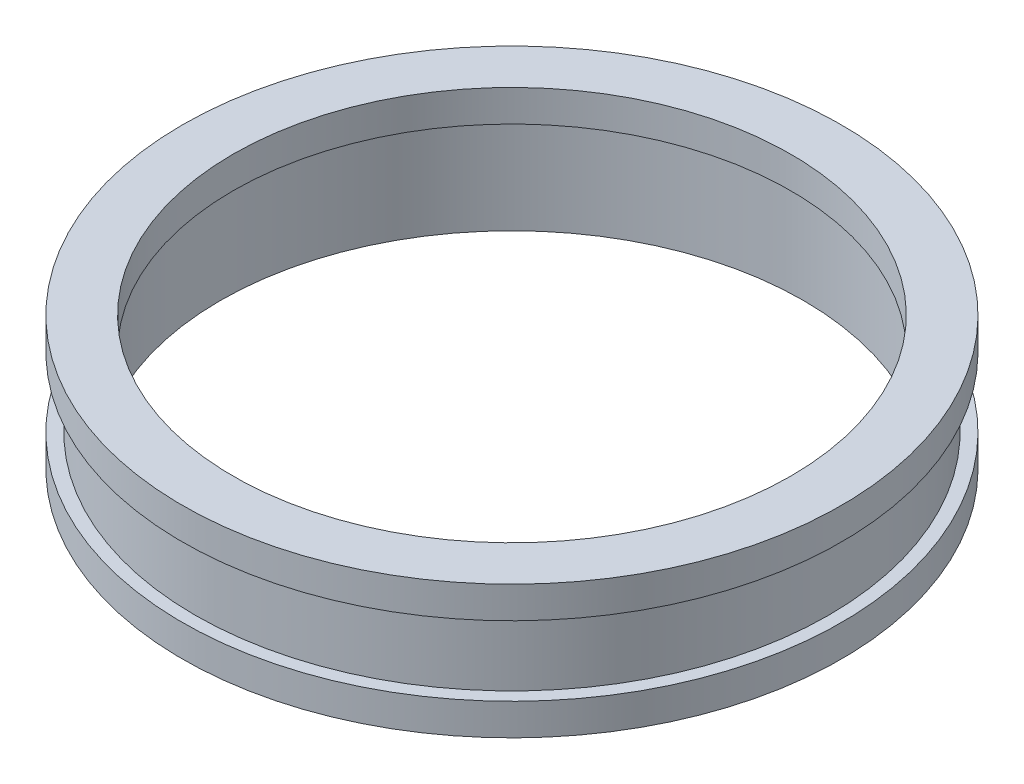
from build123d import *


with BuildPart() as part:
    # Sketch1 → Revolve1 (revolve)
    with BuildSketch(Plane(origin=(0, 0, 0), x_dir=(-1, 0, 0), z_dir=(0, 0, -1)), mode=Mode.PRIVATE) as revolve1_sk:
        Polygon((-44, 4.381196481), (-44, -0.618803519), (-46, -0.618803519), (-46, -16.618803519), (-52, -16.618803519), (-52, -11.618803519), (-50, -11.618803519), (-50, -0.618803519), (-52, -0.618803519), (-52, 4.381196481), align=None)
    revolve(revolve1_sk.sketch.rotate(Axis((0, -16.618803519, 0), (0, 1, 0)), 180), axis=Axis((0, -16.618803519, 0), (0, 1, 0)))


solid = part.part
